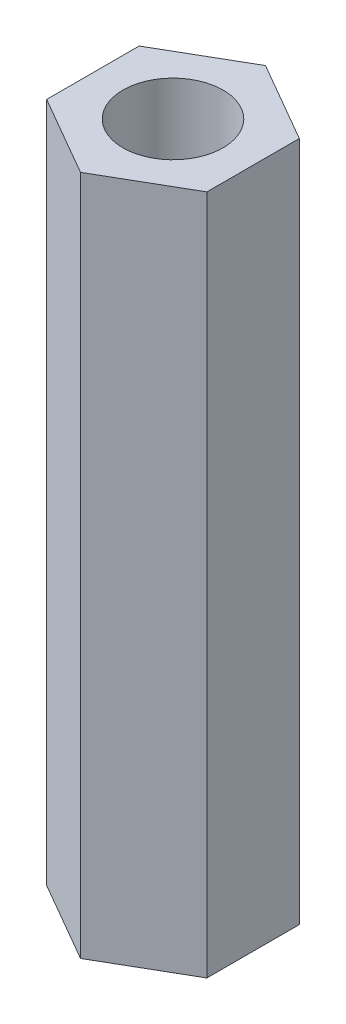
from build123d import *

# Parameters (mm, degrees)
SKETCH_1_R      = 2.5
EXTRUDE_1_DEPTH = 34


with BuildPart() as part:
    # 草图1 → 凸台-拉伸1 (new body)
    with BuildSketch(Plane(origin=(0, 0, 0), x_dir=(1, 0, 0), z_dir=(0, 1, 0))):
        Polygon((0, 4.618802154), (-4, 2.309401077), (-4, -2.309401077), (0, -4.618802154), (4, -2.309401077), (4, 2.309401077), align=None)
        with Locations(Location((0, 0, 0), (0, 0, 270))):
            Circle(SKETCH_1_R, mode=Mode.SUBTRACT)
    extrude(amount=EXTRUDE_1_DEPTH)


solid = part.part
